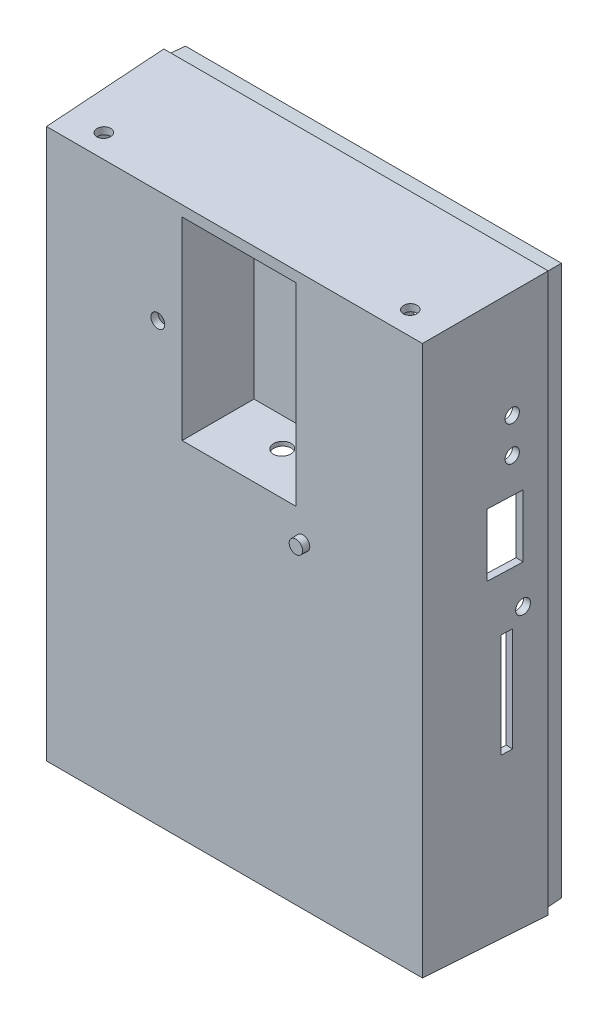
from build123d import *

# Parameters (mm, degrees)
SKETCH1_W                     = 110.69841539
SKETCH1_H                     = 160.69841539
BOSS_EXTRUDE1_DEPTH           = 35
BOSS_EXTRUDE1_TAPER           = 2
SHELL1_T                      = -2
SKETCH9_W                     = 35
SKETCH9_H                     = 58
BOSS_EXTRUDE5_DEPTH           = 32
BOSS_EXTRUDE5_TAPER           = 2
SKETCH6_W                     = 3.2
SKETCH6_H                     = 30
CUT_EXTRUDE3_DEPTH            = 2
CUT_EXTRUDE3_DRAFT            = 2
SKETCH11_W                    = 32.765070753
SKETCH11_H                    = 55.765070753
CUT_EXTRUDE4_DEPTH            = 20
CUT_EXTRUDE4_DRAFT            = -2
SKETCH13_R                    = 2.5
CUT_EXTRUDE5_DEPTH            = 1.186583
CUT_EXTRUDE5_DRAFT            = 2
SKETCH14_R                    = 4
BOSS_EXTRUDE6_DEPTH           = 18
BOSS_EXTRUDE6_DRAFT           = 2
BOSS_EXTRUDE6_PROFILE_2_DEPTH = 18
BOSS_EXTRUDE6_PROFILE_2_DRAFT = 2
BOSS_EXTRUDE6_PROFILE_3_DEPTH = 18
BOSS_EXTRUDE6_PROFILE_3_DRAFT = 2
BOSS_EXTRUDE6_PROFILE_4_DEPTH = 18
BOSS_EXTRUDE6_PROFILE_4_DRAFT = 2
SKETCH15_R                    = 2
CUT_EXTRUDE6_DEPTH            = 5
CUT_EXTRUDE6_DRAFT            = -2
CUT_EXTRUDE6_PROFILE_2_DEPTH  = 5
CUT_EXTRUDE6_PROFILE_2_DRAFT  = -2
CUT_EXTRUDE6_PROFILE_3_DEPTH  = 5
CUT_EXTRUDE6_PROFILE_3_DRAFT  = -2
CUT_EXTRUDE6_PROFILE_4_DEPTH  = 5
CUT_EXTRUDE6_PROFILE_4_DRAFT  = -2
SKETCH17_W                    = 108.695977213
SKETCH17_H                    = 158.695977213
SKETCH17_W_2                  = 106.695977213
SKETCH17_H_2                  = 156.695977213
BOSS_EXTRUDE8_DEPTH           = 5
BOSS_EXTRUDE8_DRAFT           = 2
SKETCH18_R                    = 2
BOSS_EXTRUDE9_DEPTH           = 2
BOSS_EXTRUDE9_TAPER           = 2
SKETCH19_R                    = 2
CUT_EXTRUDE7_DEPTH            = 2
CUT_EXTRUDE7_DRAFT            = -2
SKETCH26_R                    = 2
CUT_EXTRUDE11_DEPTH           = 2
CUT_EXTRUDE11_DRAFT           = 2
SKETCH27_R                    = 2
CUT_EXTRUDE12_DEPTH           = 2
CUT_EXTRUDE12_DRAFT           = 2
SKETCH29_R                    = 6
CUT_EXTRUDE15_DEPTH           = 10
CUT_EXTRUDE15_DRAFT           = 2
SKETCH32_R                    = 2
CUT_EXTRUDE16_DEPTH           = 2
CUT_EXTRUDE16_DRAFT           = -2
CUT_EXTRUDE16_PROFILE_2_DEPTH = 2
CUT_EXTRUDE16_PROFILE_2_DRAFT = -2
SKETCH32_W                    = 10
SKETCH32_H                    = 18
CUT_EXTRUDE16_PROFILE_3_DEPTH = 2
CUT_EXTRUDE16_PROFILE_3_DRAFT = -2
SKETCH34_R                    = 2
CUT_EXTRUDE17_DEPTH           = 2
CUT_EXTRUDE17_DRAFT           = -2
CUT_EXTRUDE17_PROFILE_2_DEPTH = 2
CUT_EXTRUDE17_PROFILE_2_DRAFT = -2


with BuildPart() as part:
    # Sketch1 → Boss-Extrude1 (new body)
    with BuildSketch(Plane(origin=(-178.93563268, -87.827617858, -1672.876510568), x_dir=(1, 0, 0), z_dir=(0, 0, 1))):
        with Locations((82.659063847, 86.357614413)):
            Rectangle(SKETCH1_W, SKETCH1_H)
    extrude(amount=BOSS_EXTRUDE1_DEPTH, taper=BOSS_EXTRUDE1_TAPER)

    # Shell1
    shell1_openings = [part.faces().sort_by_distance(p)[0] for p in [
        (-96.276568833, -1.470003445, -1672.876510568),
    ]]
    offset(amount=SHELL1_T, openings=shell1_openings, kind=Kind.INTERSECTION)

    # Sketch9 → Boss-Extrude5 (add)
    with BuildSketch(Plane(origin=(0, 0, -1639.876510568), x_dir=(-1, 0, 0), z_dir=(0, 0, -1))):
        with Locations((94.972172046, 46.725599768)):
            Rectangle(SKETCH9_W, SKETCH9_H)
    extrude(amount=BOSS_EXTRUDE5_DEPTH, taper=BOSS_EXTRUDE5_TAPER)


with BuildPart() as cut_extrude3_tool:
    # Sketch6 → Cut-Extrude3 (with draft: the straight prism first)
    with BuildSketch(Plane(origin=(-99.224495834, 0, -3.464995747), x_dir=(0.03489949670250102, 0, -0.9993908270190958), z_dir=(0.9993908270190958, 0, 0.03489949670250102))):
        with Locations((1658.917761042, -20.596984207)):
            Rectangle(SKETCH6_W, SKETCH6_H)
    extrude(amount=-CUT_EXTRUDE3_DEPTH)
    # Cut-Extrude3: the draft: its side faces are tilted about the plane it starts from
    cut_extrude3_sides = [cut_extrude3_tool.faces().sort_by_distance(p)[0] for p in [
        (-42.328491729, -35.596984207, -1661.407088408),
        (-42.272652535, -20.596984207, -1663.006113731),
        (-42.328491729, -5.596984207, -1661.407088408),
        (-42.384330924, -20.596984207, -1659.808063085),
    ]]
    draft(cut_extrude3_sides, Plane(origin=(-99.224495834, 0, -3.464995747), x_dir=(0.03489949670250102, 0, -0.9993908270190958), z_dir=(0.9993908270190958, 0, 0.03489949670250102)), CUT_EXTRUDE3_DRAFT)


with BuildPart() as part_1:
    add(part.part)

    # Cut-Extrude3: cut by cut_extrude3_tool
    add(cut_extrude3_tool.part, mode=Mode.SUBTRACT)


with BuildPart() as cut_extrude4_tool:
    # Sketch11 → Cut-Extrude4 (with draft: the straight prism first)
    with BuildSketch(Plane.XY.offset(-1637.876510568)):
        with Locations((-94.972172046, 46.725599769)):
            Rectangle(SKETCH11_W, SKETCH11_H)
    extrude(amount=-CUT_EXTRUDE4_DEPTH)
    # Cut-Extrude4: the draft: its side faces are tilted about the plane it starts from
    cut_extrude4_sides = [cut_extrude4_tool.faces().sort_by_distance(p)[0] for p in [
        (-111.354707422, 46.725599768, -1647.876510568),
        (-94.972172046, 18.843064392, -1647.876510568),
        (-78.589636669, 46.725599768, -1647.876510568),
        (-94.972172046, 74.608135145, -1647.876510568),
    ]]
    draft(cut_extrude4_sides, Plane.XY.offset(-1637.876510568), CUT_EXTRUDE4_DRAFT)


with BuildPart() as part_2:
    add(part_1.part)

    # Cut-Extrude4: cut by cut_extrude4_tool
    add(cut_extrude4_tool.part, mode=Mode.SUBTRACT)


with BuildPart() as cut_extrude5_tool:
    # Sketch13 → Cut-Extrude5 (with draft: the straight prism first)
    with BuildSketch(Plane(origin=(0, -39.491990943, -1.379090712), x_dir=(1, 0, 0), z_dir=(0, -0.9993908270190958, -0.03489949670250101))):
        with Locations((-94.472172046, -1649.496156617)):
            Circle(SKETCH13_R)
    extrude(amount=-CUT_EXTRUDE5_DEPTH)
    # Cut-Extrude5: the draft: its side faces are tilted about the plane it starts from
    cut_extrude5_sides = [cut_extrude5_tool.faces().sort_by_distance(p)[0] for p in [
        (-96.972172046, 18.667524818, -1649.849713264),
    ]]
    draft(cut_extrude5_sides, Plane(origin=(0, -39.491990943, -1.379090712), x_dir=(1, 0, 0), z_dir=(0, -0.9993908270190958, -0.03489949670250101)), CUT_EXTRUDE5_DRAFT)


with BuildPart() as part_3:
    add(part_2.part)

    # Cut-Extrude5: cut by cut_extrude5_tool
    add(cut_extrude5_tool.part, mode=Mode.SUBTRACT)


with BuildPart() as boss_extrude6_tool:
    # Sketch14 → Boss-Extrude6 (with draft: the straight prism first)
    with BuildSketch(Plane(origin=(0, 0, -1639.876510568), x_dir=(-1, 0, 0), z_dir=(0, 0, -1))):
        with Locations((59.079257377, -3.665606658)):
            Circle(SKETCH14_R)
    extrude(amount=BOSS_EXTRUDE6_DEPTH)
    # Boss-Extrude6: the draft: its side faces are tilted about the plane it starts from
    boss_extrude6_sides = [boss_extrude6_tool.faces().sort_by_distance(p)[0] for p in [
        (-55.079257377, -3.665606658, -1648.876510568),
    ]]
    draft(boss_extrude6_sides, Plane(origin=(0, 0, -1639.876510568), x_dir=(-1, 0, 0), z_dir=(0, 0, -1)), BOSS_EXTRUDE6_DRAFT)


with BuildPart() as part_4:
    add(part_3.part)

    # Boss-Extrude6: add boss_extrude6_tool
    add(boss_extrude6_tool.part)


with BuildPart() as boss_extrude6_profile_2_tool:
    # Sketch14 → Boss-Extrude6 profile 2 (with draft: the straight prism first)
    with BuildSketch(Plane(origin=(0, 0, -1639.876510568), x_dir=(-1, 0, 0), z_dir=(0, 0, -1))):
        with Locations((59.079257377, -43.665606658)):
            Circle(SKETCH14_R)
    extrude(amount=BOSS_EXTRUDE6_PROFILE_2_DEPTH)
    # Boss-Extrude6 profile 2: the draft: its side faces are tilted about the plane it starts from
    boss_extrude6_profile_2_sides = [boss_extrude6_profile_2_tool.faces().sort_by_distance(p)[0] for p in [
        (-55.079257377, -43.665606658, -1648.876510568),
    ]]
    draft(boss_extrude6_profile_2_sides, Plane(origin=(0, 0, -1639.876510568), x_dir=(-1, 0, 0), z_dir=(0, 0, -1)), BOSS_EXTRUDE6_PROFILE_2_DRAFT)


with BuildPart() as part_5:
    add(part_4.part)

    # Boss-Extrude6 profile 2: add boss_extrude6_profile_2_tool
    add(boss_extrude6_profile_2_tool.part)


with BuildPart() as boss_extrude6_profile_3_tool:
    # Sketch14 → Boss-Extrude6 profile 3 (with draft: the straight prism first)
    with BuildSketch(Plane(origin=(0, 0, -1639.876510568), x_dir=(-1, 0, 0), z_dir=(0, 0, -1))):
        with Locations((119.079257377, -3.665606658)):
            Circle(SKETCH14_R)
    extrude(amount=BOSS_EXTRUDE6_PROFILE_3_DEPTH)
    # Boss-Extrude6 profile 3: the draft: its side faces are tilted about the plane it starts from
    boss_extrude6_profile_3_sides = [boss_extrude6_profile_3_tool.faces().sort_by_distance(p)[0] for p in [
        (-115.079257377, -3.665606658, -1648.876510568),
    ]]
    draft(boss_extrude6_profile_3_sides, Plane(origin=(0, 0, -1639.876510568), x_dir=(-1, 0, 0), z_dir=(0, 0, -1)), BOSS_EXTRUDE6_PROFILE_3_DRAFT)


with BuildPart() as part_6:
    add(part_5.part)

    # Boss-Extrude6 profile 3: add boss_extrude6_profile_3_tool
    add(boss_extrude6_profile_3_tool.part)


with BuildPart() as boss_extrude6_profile_4_tool:
    # Sketch14 → Boss-Extrude6 profile 4 (with draft: the straight prism first)
    with BuildSketch(Plane(origin=(0, 0, -1639.876510568), x_dir=(-1, 0, 0), z_dir=(0, 0, -1))):
        with Locations((119.079257377, -43.665606658)):
            Circle(SKETCH14_R)
    extrude(amount=BOSS_EXTRUDE6_PROFILE_4_DEPTH)
    # Boss-Extrude6 profile 4: the draft: its side faces are tilted about the plane it starts from
    boss_extrude6_profile_4_sides = [boss_extrude6_profile_4_tool.faces().sort_by_distance(p)[0] for p in [
        (-115.079257377, -43.665606658, -1648.876510568),
    ]]
    draft(boss_extrude6_profile_4_sides, Plane(origin=(0, 0, -1639.876510568), x_dir=(-1, 0, 0), z_dir=(0, 0, -1)), BOSS_EXTRUDE6_PROFILE_4_DRAFT)


with BuildPart() as part_7:
    add(part_6.part)

    # Boss-Extrude6 profile 4: add boss_extrude6_profile_4_tool
    add(boss_extrude6_profile_4_tool.part)


with BuildPart() as cut_extrude6_tool:
    # Sketch15 → Cut-Extrude6 (with draft: the straight prism first)
    with BuildSketch(Plane(origin=(0, 0, -1657.876510568), x_dir=(-1, 0, 0), z_dir=(0, 0, -1))):
        with Locations((59.079257377, -3.665606658)):
            Circle(SKETCH15_R)
    extrude(amount=-CUT_EXTRUDE6_DEPTH)
    # Cut-Extrude6: the draft: its side faces are tilted about the plane it starts from
    cut_extrude6_sides = [cut_extrude6_tool.faces().sort_by_distance(p)[0] for p in [
        (-57.079257377, -3.665606658, -1655.376510568),
    ]]
    draft(cut_extrude6_sides, Plane(origin=(0, 0, -1657.876510568), x_dir=(-1, 0, 0), z_dir=(0, 0, -1)), CUT_EXTRUDE6_DRAFT)


with BuildPart() as part_8:
    add(part_7.part)

    # Cut-Extrude6: cut by cut_extrude6_tool
    add(cut_extrude6_tool.part, mode=Mode.SUBTRACT)


with BuildPart() as cut_extrude6_profile_2_tool:
    # Sketch15 → Cut-Extrude6 profile 2 (with draft: the straight prism first)
    with BuildSketch(Plane(origin=(0, 0, -1657.876510568), x_dir=(-1, 0, 0), z_dir=(0, 0, -1))):
        with Locations((119.079257377, -3.665606658)):
            Circle(SKETCH15_R)
    extrude(amount=-CUT_EXTRUDE6_PROFILE_2_DEPTH)
    # Cut-Extrude6 profile 2: the draft: its side faces are tilted about the plane it starts from
    cut_extrude6_profile_2_sides = [cut_extrude6_profile_2_tool.faces().sort_by_distance(p)[0] for p in [
        (-117.079257377, -3.665606658, -1655.376510568),
    ]]
    draft(cut_extrude6_profile_2_sides, Plane(origin=(0, 0, -1657.876510568), x_dir=(-1, 0, 0), z_dir=(0, 0, -1)), CUT_EXTRUDE6_PROFILE_2_DRAFT)


with BuildPart() as part_9:
    add(part_8.part)

    # Cut-Extrude6 profile 2: cut by cut_extrude6_profile_2_tool
    add(cut_extrude6_profile_2_tool.part, mode=Mode.SUBTRACT)


with BuildPart() as cut_extrude6_profile_3_tool:
    # Sketch15 → Cut-Extrude6 profile 3 (with draft: the straight prism first)
    with BuildSketch(Plane(origin=(0, 0, -1657.876510568), x_dir=(-1, 0, 0), z_dir=(0, 0, -1))):
        with Locations((119.079257377, -43.665606658)):
            Circle(SKETCH15_R)
    extrude(amount=-CUT_EXTRUDE6_PROFILE_3_DEPTH)
    # Cut-Extrude6 profile 3: the draft: its side faces are tilted about the plane it starts from
    cut_extrude6_profile_3_sides = [cut_extrude6_profile_3_tool.faces().sort_by_distance(p)[0] for p in [
        (-117.079257377, -43.665606658, -1655.376510568),
    ]]
    draft(cut_extrude6_profile_3_sides, Plane(origin=(0, 0, -1657.876510568), x_dir=(-1, 0, 0), z_dir=(0, 0, -1)), CUT_EXTRUDE6_PROFILE_3_DRAFT)


with BuildPart() as part_10:
    add(part_9.part)

    # Cut-Extrude6 profile 3: cut by cut_extrude6_profile_3_tool
    add(cut_extrude6_profile_3_tool.part, mode=Mode.SUBTRACT)


with BuildPart() as cut_extrude6_profile_4_tool:
    # Sketch15 → Cut-Extrude6 profile 4 (with draft: the straight prism first)
    with BuildSketch(Plane(origin=(0, 0, -1657.876510568), x_dir=(-1, 0, 0), z_dir=(0, 0, -1))):
        with Locations((59.079257377, -43.665606658)):
            Circle(SKETCH15_R)
    extrude(amount=-CUT_EXTRUDE6_PROFILE_4_DEPTH)
    # Cut-Extrude6 profile 4: the draft: its side faces are tilted about the plane it starts from
    cut_extrude6_profile_4_sides = [cut_extrude6_profile_4_tool.faces().sort_by_distance(p)[0] for p in [
        (-57.079257377, -43.665606658, -1655.376510568),
    ]]
    draft(cut_extrude6_profile_4_sides, Plane(origin=(0, 0, -1657.876510568), x_dir=(-1, 0, 0), z_dir=(0, 0, -1)), CUT_EXTRUDE6_PROFILE_4_DRAFT)


with BuildPart() as part_11:
    add(part_10.part)

    # Cut-Extrude6 profile 4: cut by cut_extrude6_profile_4_tool
    add(cut_extrude6_profile_4_tool.part, mode=Mode.SUBTRACT)


with BuildPart() as boss_extrude8_tool:
    # Sketch17 → Boss-Extrude8 (with draft: the straight prism first)
    with BuildSketch(Plane(origin=(0, 0, -1672.876510568), x_dir=(-1, 0, 0), z_dir=(0, 0, -1))):
        with Locations((96.276568833, -1.470003445)):
            Rectangle(SKETCH17_W, SKETCH17_H)
        with Locations((96.276568833, -1.470003445)):
            Rectangle(SKETCH17_W_2, SKETCH17_H_2, mode=Mode.SUBTRACT)
    extrude(amount=BOSS_EXTRUDE8_DEPTH)
    # Boss-Extrude8: the draft: its side faces are tilted about the plane it starts from
    boss_extrude8_sides = [boss_extrude8_tool.faces().sort_by_distance(p)[0] for p in [
        (-41.928580226, -1.470003445, -1675.376510568),
        (-96.276568833, -80.817992051, -1675.376510568),
        (-150.624557439, -1.470003445, -1675.376510568),
        (-96.276568833, 77.877985162, -1675.376510568),
        (-96.276568833, -79.817992051, -1675.376510568),
        (-42.928580226, -1.470003445, -1675.376510568),
        (-96.276568833, 76.877985162, -1675.376510568),
        (-149.624557439, -1.470003445, -1675.376510568),
    ]]
    draft(boss_extrude8_sides, Plane(origin=(0, 0, -1672.876510568), x_dir=(-1, 0, 0), z_dir=(0, 0, -1)), BOSS_EXTRUDE8_DRAFT)


with BuildPart() as part_12:
    add(part_11.part)

    # Boss-Extrude8: add boss_extrude8_tool
    add(boss_extrude8_tool.part)

    # Sketch18 → Boss-Extrude9 (add)
    with BuildSketch(Plane.XY.offset(-1637.876510568)):
        with Locations((-76.589636669, 10.725599768)):
            Circle(SKETCH18_R)
    extrude(amount=BOSS_EXTRUDE9_DEPTH, taper=BOSS_EXTRUDE9_TAPER)


with BuildPart() as cut_extrude7_tool:
    # Sketch19 → Cut-Extrude7 (with draft: the straight prism first)
    with BuildSketch(Plane.XY.offset(-1637.876510568)):
        with Locations((-118.354707422, 45.243064392)):
            Circle(SKETCH19_R)
    extrude(amount=-CUT_EXTRUDE7_DEPTH)
    # Cut-Extrude7: the draft: its side faces are tilted about the plane it starts from
    cut_extrude7_sides = [cut_extrude7_tool.faces().sort_by_distance(p)[0] for p in [
        (-120.354707422, 45.243064392, -1638.876510568),
    ]]
    draft(cut_extrude7_sides, Plane.XY.offset(-1637.876510568), CUT_EXTRUDE7_DRAFT)


with BuildPart() as part_13:
    add(part_12.part)

    # Cut-Extrude7: cut by cut_extrude7_tool
    add(cut_extrude7_tool.part, mode=Mode.SUBTRACT)


with BuildPart() as cut_extrude11_tool:
    # Sketch26 → Cut-Extrude11 (with draft: the straight prism first)
    with BuildSketch(Plane(origin=(-91.095335295, 0, 3.181119206), x_dir=(-0.03489949670250101, 0, -0.9993908270190958), z_dir=(0.9993908270190958, 0, -0.03489949670250101))):
        with Locations((1670.149102685, -1.470003445)):
            Circle(SKETCH26_R)
    extrude(amount=-CUT_EXTRUDE11_DEPTH)
    # Cut-Extrude11: the draft: its side faces are tilted about the plane it starts from
    cut_extrude11_sides = [cut_extrude11_tool.faces().sort_by_distance(p)[0] for p in [
        (-150.31229023, -1.470003445, -1663.916892622),
    ]]
    draft(cut_extrude11_sides, Plane(origin=(-91.095335295, 0, 3.181119206), x_dir=(-0.03489949670250101, 0, -0.9993908270190958), z_dir=(0.9993908270190958, 0, -0.03489949670250101)), CUT_EXTRUDE11_DRAFT)


with BuildPart() as part_14:
    add(part_13.part)

    # Cut-Extrude11: cut by cut_extrude11_tool
    add(cut_extrude11_tool.part, mode=Mode.SUBTRACT)


with BuildPart() as cut_extrude12_tool:
    # Sketch27 → Cut-Extrude12 (with draft: the straight prism first)
    with BuildSketch(Plane(origin=(-101.223277488, 0, -3.53479474), x_dir=(-0.03489949670250102, 0, 0.9993908270190958), z_dir=(-0.9993908270190958, 0, -0.03489949670250102))):
        with Locations((-1663.429095092, -1.470003445)):
            Circle(SKETCH27_R)
    extrude(amount=-CUT_EXTRUDE12_DEPTH)
    # Cut-Extrude12: the draft: its side faces are tilted about the plane it starts from
    cut_extrude12_sides = [cut_extrude12_tool.faces().sort_by_distance(p)[0] for p in [
        (-42.101249448, -1.470003445, -1667.91445593),
    ]]
    draft(cut_extrude12_sides, Plane(origin=(-101.223277488, 0, -3.53479474), x_dir=(-0.03489949670250102, 0, 0.9993908270190958), z_dir=(-0.9993908270190958, 0, -0.03489949670250102)), CUT_EXTRUDE12_DRAFT)


with BuildPart() as part_15:
    add(part_14.part)

    # Cut-Extrude12: cut by cut_extrude12_tool
    add(cut_extrude12_tool.part, mode=Mode.SUBTRACT)


with BuildPart() as cut_extrude15_tool:
    # Sketch29 → Cut-Extrude15 (with draft: the straight prism first)
    with BuildSketch(Plane(origin=(-93.094116949, 0, 3.250918199), x_dir=(0.03489949670250101, 0, 0.9993908270190958), z_dir=(-0.9993908270190958, 0, 0.03489949670250101))):
        with Locations((-1662.149102685, -30.596984207)):
            Circle(SKETCH29_R)
    extrude(amount=-CUT_EXTRUDE15_DEPTH)
    # Cut-Extrude15: the draft: its side faces are tilted about the plane it starts from
    cut_extrude15_sides = [cut_extrude15_tool.faces().sort_by_distance(p)[0] for p in [
        (-146.314726922, -30.596984207, -1664.056490608),
    ]]
    draft(cut_extrude15_sides, Plane(origin=(-93.094116949, 0, 3.250918199), x_dir=(0.03489949670250101, 0, 0.9993908270190958), z_dir=(-0.9993908270190958, 0, 0.03489949670250101)), CUT_EXTRUDE15_DRAFT)


with BuildPart() as part_16:
    add(part_15.part)

    # Cut-Extrude15: cut by cut_extrude15_tool
    add(cut_extrude15_tool.part, mode=Mode.SUBTRACT)


with BuildPart() as cut_extrude16_tool:
    # Sketch32 → Cut-Extrude16 (with draft: the straight prism first)
    with BuildSketch(Plane(origin=(-99.224495834, 0, -3.464995747), x_dir=(0.03489949670250102, 0, -0.9993908270190958), z_dir=(0.9993908270190958, 0, 0.03489949670250102))):
        with Locations((1660.407761042, 47.656977318)):
            Circle(SKETCH32_R)
    extrude(amount=-CUT_EXTRUDE16_DEPTH)
    # Cut-Extrude16: the draft: its side faces are tilted about the plane it starts from
    cut_extrude16_sides = [cut_extrude16_tool.faces().sort_by_distance(p)[0] for p in [
        (-42.346290473, 47.656977318, -1660.897399086),
    ]]
    draft(cut_extrude16_sides, Plane(origin=(-99.224495834, 0, -3.464995747), x_dir=(0.03489949670250102, 0, -0.9993908270190958), z_dir=(0.9993908270190958, 0, 0.03489949670250102)), CUT_EXTRUDE16_DRAFT)


with BuildPart() as part_17:
    add(part_16.part)

    # Cut-Extrude16: cut by cut_extrude16_tool
    add(cut_extrude16_tool.part, mode=Mode.SUBTRACT)


with BuildPart() as cut_extrude16_profile_2_tool:
    # Sketch32 → Cut-Extrude16 profile 2 (with draft: the straight prism first)
    with BuildSketch(Plane(origin=(-99.224495834, 0, -3.464995747), x_dir=(0.03489949670250102, 0, -0.9993908270190958), z_dir=(0.9993908270190958, 0, 0.03489949670250102))):
        with Locations((1660.407761042, 37.656977318)):
            Circle(SKETCH32_R)
    extrude(amount=-CUT_EXTRUDE16_PROFILE_2_DEPTH)
    # Cut-Extrude16 profile 2: the draft: its side faces are tilted about the plane it starts from
    cut_extrude16_profile_2_sides = [cut_extrude16_profile_2_tool.faces().sort_by_distance(p)[0] for p in [
        (-42.346290473, 37.656977318, -1660.897399086),
    ]]
    draft(cut_extrude16_profile_2_sides, Plane(origin=(-99.224495834, 0, -3.464995747), x_dir=(0.03489949670250102, 0, -0.9993908270190958), z_dir=(0.9993908270190958, 0, 0.03489949670250102)), CUT_EXTRUDE16_PROFILE_2_DRAFT)


with BuildPart() as part_18:
    add(part_17.part)

    # Cut-Extrude16 profile 2: cut by cut_extrude16_profile_2_tool
    add(cut_extrude16_profile_2_tool.part, mode=Mode.SUBTRACT)


with BuildPart() as cut_extrude16_profile_3_tool:
    # Sketch32 → Cut-Extrude16 profile 3 (with draft: the straight prism first)
    with BuildSketch(Plane(origin=(-99.224495834, 0, -3.464995747), x_dir=(0.03489949670250102, 0, -0.9993908270190958), z_dir=(0.9993908270190958, 0, 0.03489949670250102))):
        with Locations((1658.429095092, 18.656977318)):
            Rectangle(SKETCH32_W, SKETCH32_H)
    extrude(amount=-CUT_EXTRUDE16_PROFILE_3_DEPTH)
    # Cut-Extrude16 profile 3: the draft: its side faces are tilted about the plane it starts from
    cut_extrude16_profile_3_sides = [cut_extrude16_profile_3_tool.faces().sort_by_distance(p)[0] for p in [
        (-42.171048442, 18.656977318, -1665.915674276),
        (-42.345545925, 27.656977318, -1660.918720141),
        (-42.520043409, 18.656977318, -1655.921766006),
        (-42.345545925, 9.656977318, -1660.918720141),
    ]]
    draft(cut_extrude16_profile_3_sides, Plane(origin=(-99.224495834, 0, -3.464995747), x_dir=(0.03489949670250102, 0, -0.9993908270190958), z_dir=(0.9993908270190958, 0, 0.03489949670250102)), CUT_EXTRUDE16_PROFILE_3_DRAFT)


with BuildPart() as part_19:
    add(part_18.part)

    # Cut-Extrude16 profile 3: cut by cut_extrude16_profile_3_tool
    add(cut_extrude16_profile_3_tool.part, mode=Mode.SUBTRACT)


with BuildPart() as cut_extrude17_tool:
    # Sketch34 → Cut-Extrude17 (with draft: the straight prism first)
    with BuildSketch(Plane(origin=(0, 20.436148168, 0.713646019), x_dir=(1, 0, 0), z_dir=(0, 0.9993908270190958, 0.03489949670250101))):
        with Locations((-140.403549595, 1646.088949876)):
            Circle(SKETCH34_R)
    extrude(amount=-CUT_EXTRUDE17_DEPTH)
    # Cut-Extrude17: the draft: its side faces are tilted about the plane it starts from
    cut_extrude17_sides = [cut_extrude17_tool.faces().sort_by_distance(p)[0] for p in [
        (-142.403549595, 76.88443322, -1644.40745044),
    ]]
    draft(cut_extrude17_sides, Plane(origin=(0, 20.436148168, 0.713646019), x_dir=(1, 0, 0), z_dir=(0, 0.9993908270190958, 0.03489949670250101)), CUT_EXTRUDE17_DRAFT)


with BuildPart() as part_20:
    add(part_19.part)

    # Cut-Extrude17: cut by cut_extrude17_tool
    add(cut_extrude17_tool.part, mode=Mode.SUBTRACT)


with BuildPart() as cut_extrude17_profile_2_tool:
    # Sketch34 → Cut-Extrude17 profile 2 (with draft: the straight prism first)
    with BuildSketch(Plane(origin=(0, 20.436148168, 0.713646019), x_dir=(1, 0, 0), z_dir=(0, 0.9993908270190958, 0.03489949670250101))):
        with Locations((-52.14958807, 1646.088949876)):
            Circle(SKETCH34_R)
    extrude(amount=-CUT_EXTRUDE17_PROFILE_2_DEPTH)
    # Cut-Extrude17 profile 2: the draft: its side faces are tilted about the plane it starts from
    cut_extrude17_profile_2_sides = [cut_extrude17_profile_2_tool.faces().sort_by_distance(p)[0] for p in [
        (-54.14958807, 76.88443322, -1644.40745044),
    ]]
    draft(cut_extrude17_profile_2_sides, Plane(origin=(0, 20.436148168, 0.713646019), x_dir=(1, 0, 0), z_dir=(0, 0.9993908270190958, 0.03489949670250101)), CUT_EXTRUDE17_PROFILE_2_DRAFT)


with BuildPart() as part_21:
    add(part_20.part)

    # Cut-Extrude17 profile 2: cut by cut_extrude17_profile_2_tool
    add(cut_extrude17_profile_2_tool.part, mode=Mode.SUBTRACT)


solid = part_21.part
